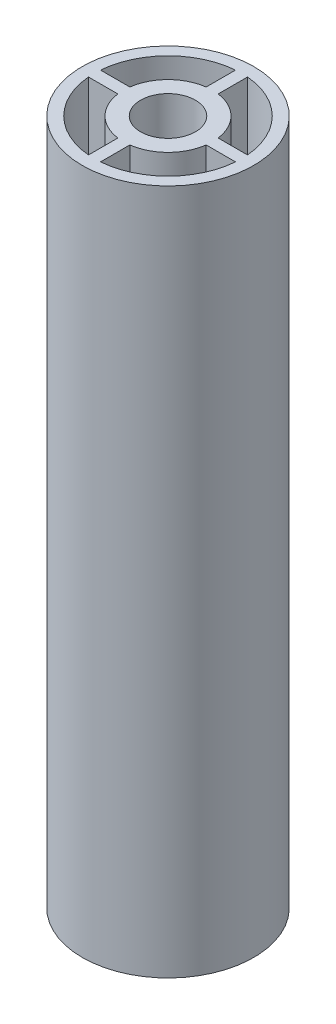
from build123d import *

# Parameters (mm, degrees)
SKETCH_1_R      = 5
SKETCH_1_R_2    = 1.6
EXTRUDE_1_DEPTH = 40


with BuildPart() as part:
    # 草图1 → 凸台-拉伸1 (new body)
    with BuildSketch(Plane(origin=(0, 0, 0), x_dir=(1, 0, 0), z_dir=(0, 1, 0))):
        with Locations(Location((0, 0, 0), (0, 0, 270))):
            Circle(SKETCH_1_R)
        with Locations(Location((0, 0, 0), (0, 0, 270))):
            Circle(SKETCH_1_R_2, mode=Mode.SUBTRACT)
        with BuildLine():
            ThreePointArc((4.285732143, 0.35), (3.040559159, 3.040559159), (0.35, 4.285732143))
            Line((0.35, 4.285732143), (0.35, 2.576334606))
            ThreePointArc((0.35, 2.576334606), (1.838477631, 1.838477631), (2.576334606, 0.35))
            Line((2.576334606, 0.35), (4.285732143, 0.35))
        make_face(mode=Mode.SUBTRACT)
        with BuildLine():
            ThreePointArc((0.35, -4.285732143), (3.040559159, -3.040559159), (4.285732143, -0.35))
            Line((4.285732143, -0.35), (2.576334606, -0.35))
            ThreePointArc((2.576334606, -0.35), (1.838477631, -1.838477631), (0.35, -2.576334606))
            Line((0.35, -2.576334606), (0.35, -4.285732143))
        make_face(mode=Mode.SUBTRACT)
        with BuildLine():
            ThreePointArc((-4.285732143, -0.35), (-3.040559159, -3.040559159), (-0.35, -4.285732143))
            Line((-0.35, -4.285732143), (-0.35, -2.576334606))
            ThreePointArc((-0.35, -2.576334606), (-1.838477631, -1.838477631), (-2.576334606, -0.35))
            Line((-2.576334606, -0.35), (-4.285732143, -0.35))
        make_face(mode=Mode.SUBTRACT)
        with BuildLine():
            ThreePointArc((-0.35, 4.285732143), (-3.040559159, 3.040559159), (-4.285732143, 0.35))
            Line((-4.285732143, 0.35), (-2.576334606, 0.35))
            ThreePointArc((-2.576334606, 0.35), (-1.838477631, 1.838477631), (-0.35, 2.576334606))
            Line((-0.35, 2.576334606), (-0.35, 4.285732143))
        make_face(mode=Mode.SUBTRACT)
    extrude(amount=EXTRUDE_1_DEPTH)


solid = part.part
